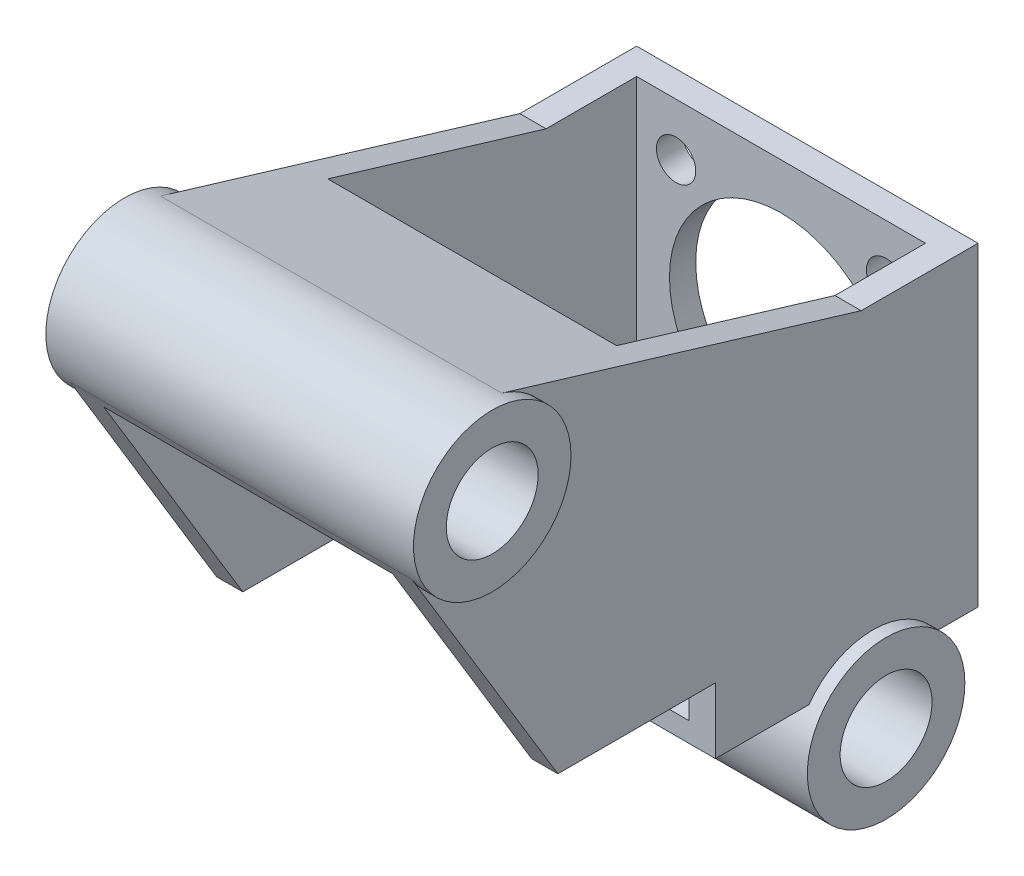
from build123d import *

# Parameters (mm, degrees)
SKETCH1_R             = 6
SKETCH1_R_2           = 3.5
BOSS_EXTRUDE1_DEPTH   = 14
BOSS_EXTRUDE1_2_DEPTH = 14
BOSS_EXTRUDE2_DEPTH   = 13
CUT_EXTRUDE2_DEPTH    = 11
SKETCH5_R             = 8.5
SKETCH5_R_2           = 1.5
CUT_EXTRUDE3_DEPTH    = 2


with BuildPart() as part:
    # Sketch1 → Boss-Extrude1 (new, symmetric)
    with BuildSketch(Plane(origin=(0, 0, 0), x_dir=(0, 0, -1), z_dir=(1, 0, 0))):
        with Locations((-30, 15)):
            Circle(SKETCH1_R)
        with Locations((-30, 15)):
            Circle(SKETCH1_R_2, mode=Mode.SUBTRACT)
    extrude(amount=BOSS_EXTRUDE1_DEPTH, both=True)


with BuildPart() as body_2:
    # Sketch1 → Boss-Extrude1 2 (new, symmetric)
    with BuildSketch(Plane(origin=(0, 0, 0), x_dir=(0, 0, -1), z_dir=(1, 0, 0))):
        with Locations((0, -15)):
            Circle(SKETCH1_R)
        with Locations((0, -15)):
            Circle(SKETCH1_R_2, mode=Mode.SUBTRACT)
    extrude(amount=BOSS_EXTRUDE1_2_DEPTH, both=True)

    # Sketch2 → Boss-Extrude2 (add, symmetric)
    with BuildSketch(Plane(origin=(0, 0, 0), x_dir=(0, 0, -1), z_dir=(1, 0, 0))):
        with BuildLine():
            Line((8, 12.5), (8, -11.5))
            Line((8, -11.5), (-12, -11.5))
            Line((-12, -11.5), (-12, -6.5))
            Line((-12, -6.5), (-24, -6.5))
            Line((-24, -6.5), (-35.132965379, 11.893125941))
            ThreePointArc((-35.132965379, 11.893125941), (-25.25839516, 11.323427745), (-28.269359085, 20.744987556))
            Line((-28.269359085, 20.744987556), (-0.899527194, 12.5))
            Line((-0.899527194, 12.5), (8, 12.5))
        make_face()
    extrude(amount=BOSS_EXTRUDE2_DEPTH, both=True)


with BuildPart() as cut_extrude2_tool:
    # Sketch4 → Cut-Extrude2 (new, symmetric)
    with BuildSketch(Plane(origin=(0, 0, 0), x_dir=(0, 0, -1), z_dir=(1, 0, 0))):
        Polygon((6, 12.5), (-0.899527194, 12.5), (-17.529603633, 17.509704621), (-17.529603633, 11), (-36, 11), (-36, -10), (6, -10), align=None)
    extrude(amount=CUT_EXTRUDE2_DEPTH, both=True)


with BuildPart() as part_1:
    add(part.part)

    # Cut-Extrude2: cut by cut_extrude2_tool
    add(cut_extrude2_tool.part, mode=Mode.SUBTRACT)


with BuildPart() as body_2_1:
    add(body_2.part)

    # Cut-Extrude2: cut by cut_extrude2_tool
    add(cut_extrude2_tool.part, mode=Mode.SUBTRACT)

    # Sketch5 → Cut-Extrude3 (cut)
    with BuildSketch(Plane(origin=(0, 0, -8), x_dir=(-1, 0, 0), z_dir=(0, 0, -1))):
        with Locations(Location((0, 0.5, 0), (0, 0, 90))):
            Circle(SKETCH5_R)
        with Locations(Location((-8, 8.5, 0), (0, 0, 90))):
            Circle(SKETCH5_R_2)
        with Locations(Location((-8, -7.5, 0), (0, 0, 90))):
            Circle(SKETCH5_R_2)
        with Locations(Location((8, 8.5, 0), (0, 0, 90))):
            Circle(SKETCH5_R_2)
        with Locations(Location((8, -7.5, 0), (0, 0, 90))):
            Circle(SKETCH5_R_2)
    extrude(amount=-CUT_EXTRUDE3_DEPTH, mode=Mode.SUBTRACT)


solid = Compound([part_1.part, body_2_1.part])
